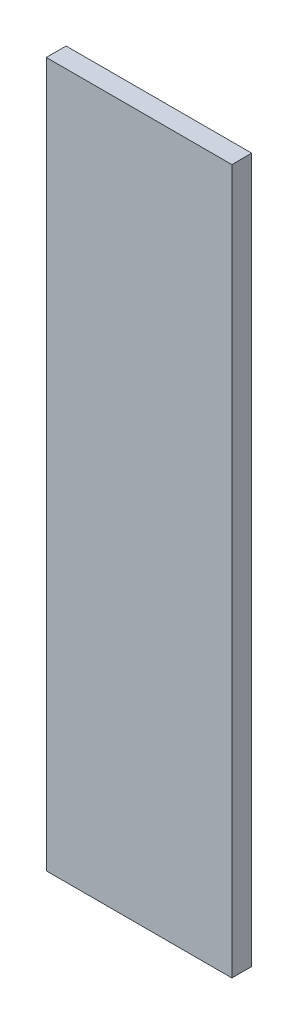
from build123d import *

# Parameters (mm, degrees)
SKETCH1_W           = 168.6
SKETCH1_H           = 640
BOSS_EXTRUDE1_DEPTH = 18


with BuildPart() as part:
    # Sketch1 → Boss-Extrude1 (new body)
    with BuildSketch(Plane.XY):
        with Locations((97, 283.5)):
            Rectangle(SKETCH1_W, SKETCH1_H)
    extrude(amount=BOSS_EXTRUDE1_DEPTH)


solid = part.part
